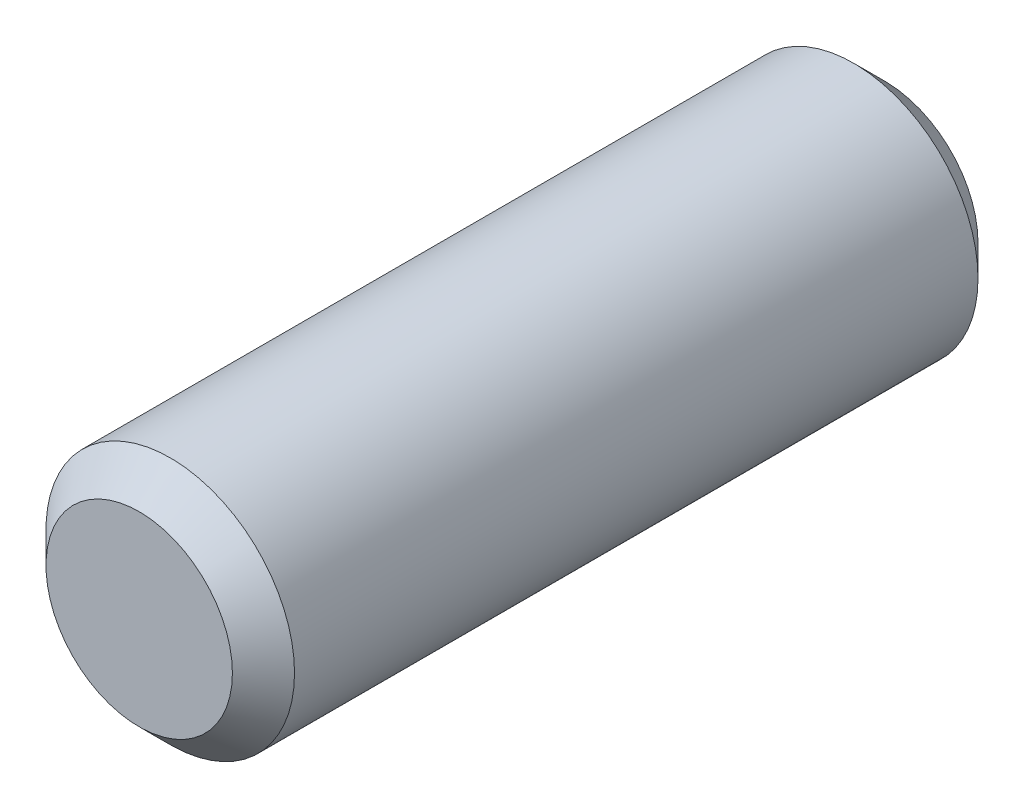
from build123d import *

# Parameters (mm, degrees)
ESQUISSE1_R        = 2
BOSS_EXTRU_1_DEPTH = 6
CHANFREIN1_SIZE    = 0.5


with BuildPart() as part:
    # Esquisse1 → Boss.-Extru.1 (new, symmetric)
    with BuildSketch(Plane.XY):
        Circle(ESQUISSE1_R)
    extrude(amount=BOSS_EXTRU_1_DEPTH, both=True)

    # Chanfrein1
    chanfrein1_edges = [part.edges().sort_by_distance(p)[0] for p in [
        (-2, 0, -6),
        (-2, 0, 6),
    ]]
    chamfer(chanfrein1_edges, length=CHANFREIN1_SIZE)


solid = part.part
